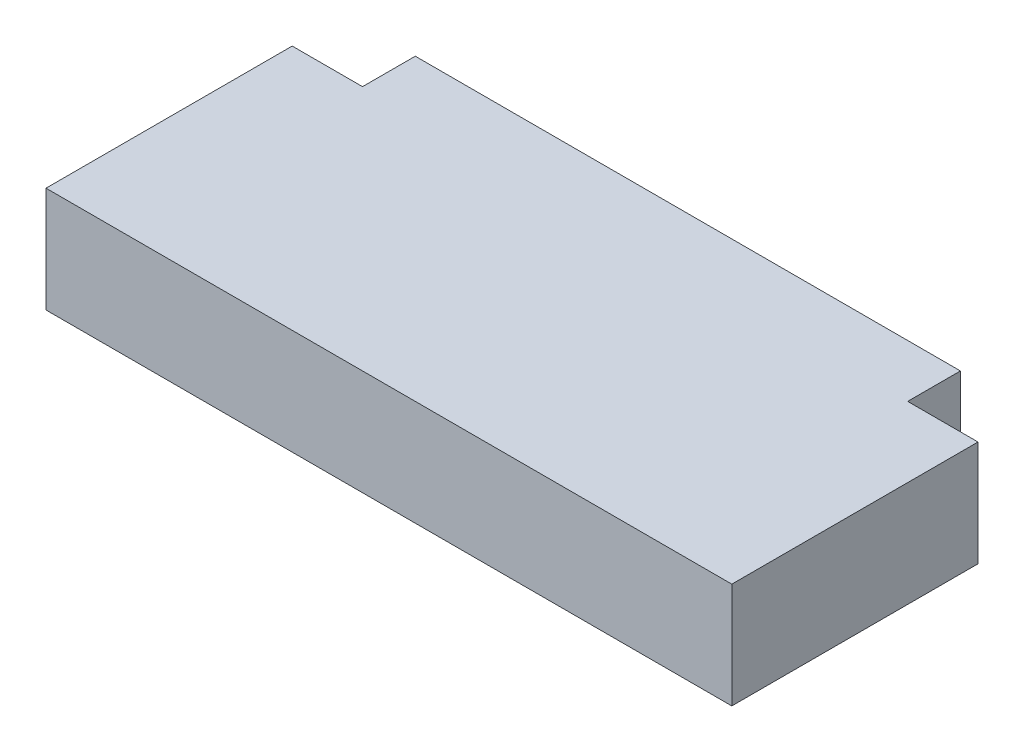
from build123d import *

# Parameters (mm, degrees)
SKETCH1_W           = 19.5
SKETCH1_H           = 8.5
BOSS_EXTRUDE1_DEPTH = 3
SKETCH2_W           = 2
SKETCH2_H           = 1.5
CUT_EXTRUDE1_DEPTH  = 13.488555679


with BuildPart() as part:
    # Sketch1 → Boss-Extrude1 (new body)
    with BuildSketch(Plane(origin=(0, 0, 0), x_dir=(1, 0, 0), z_dir=(0, 1, 0))):
        with Locations((0.75, -1.809209762)):
            Rectangle(SKETCH1_W, SKETCH1_H)
    extrude(amount=BOSS_EXTRUDE1_DEPTH)

    # Sketch2 → Cut-Extrude1 (cut, through all)
    with BuildSketch(Plane(origin=(0, 3, 0), x_dir=(1, 0, 0), z_dir=(0, 1, 0))):
        with Locations((-8, 1.690790238)):
            Rectangle(SKETCH2_W, SKETCH2_H)
        with Locations((9.5, 1.690790238)):
            Rectangle(SKETCH2_W, SKETCH2_H)
    extrude(amount=-CUT_EXTRUDE1_DEPTH, mode=Mode.SUBTRACT)


solid = part.part
